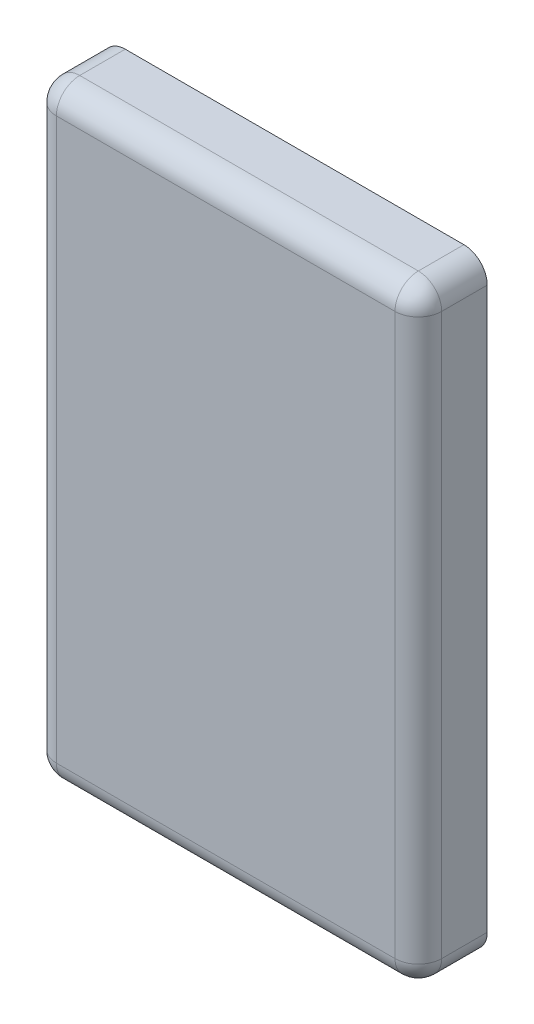
from build123d import *

# Parameters (mm, degrees)
CROQUIS1_W              = 520
CROQUIS1_H              = 330
SALIENTE_EXTRUIR1_DEPTH = 9
CROQUIS2_W              = 330
CROQUIS2_H              = 520
SALIENTE_EXTRUIR2_DEPTH = 50
REDONDEO1_R             = 20


with BuildPart() as part:
    # Croquis1 → Saliente-Extruir1 (new body)
    with BuildSketch(Plane(origin=(0, 0, 0), x_dir=(0, 1, 0), z_dir=(0, 0, 1))):
        Rectangle(CROQUIS1_W, CROQUIS1_H)
    extrude(amount=SALIENTE_EXTRUIR1_DEPTH)

    # Croquis2 → Saliente-Extruir2 (add)
    with BuildSketch(Plane.XY.offset(9)):
        Rectangle(CROQUIS2_W, CROQUIS2_H)
    extrude(amount=SALIENTE_EXTRUIR2_DEPTH)

    # Redondeo1
    redondeo1_edges = [part.edges().sort_by_distance(p)[0] for p in [
        (165, 0, 59),
        (0, 260, 59),
        (-165, 0, 59),
        (0, -260, 59),
        (165, 260, 29.5),
        (165, -260, 29.5),
        (-165, -260, 29.5),
        (-165, 260, 29.5),
    ]]
    fillet(redondeo1_edges, radius=REDONDEO1_R)


solid = part.part
